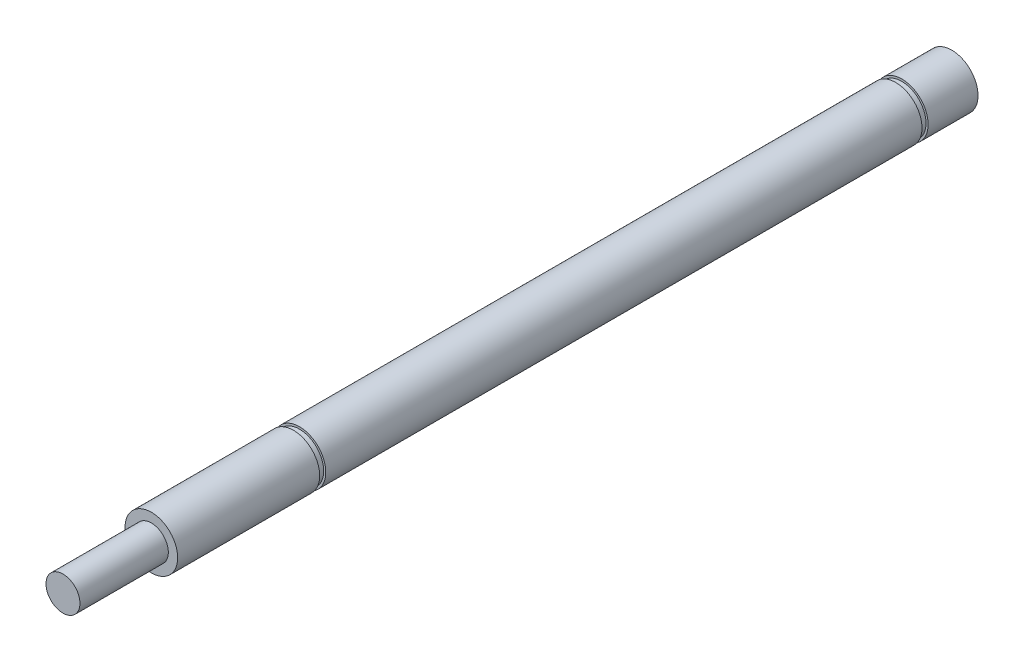
from build123d import *


with BuildPart() as part:
    # Sketch1 → Revolve1 (revolve)
    with BuildSketch(Plane(origin=(15.304322218, 0, 0), x_dir=(0, 0, -1), z_dir=(1, 0, 0)), mode=Mode.PRIVATE) as revolve1_sk:
        Polygon((13.97, 27.878467802), (-3.175, 27.878467802), (-3.175, 26.753467802), (-13.843, 26.753467802), (-13.843, 24.703467802), (93.445553682, 24.703467802), (93.445553682, 27.878467802), (87.419403682, 27.878467802), (87.419403682, 27.624467802), (86.682803682, 27.624467802), (86.682803682, 27.878467802), (65.655613748, 27.878467802), (14.7066, 27.878467802), (14.7066, 27.624467802), (13.97, 27.624467802), align=None)
    revolve(revolve1_sk.sketch.rotate(Axis((15.304322218, 24.703467802, -93.445553682), (0, 0, 1)), 90), axis=Axis((15.304322218, 24.703467802, -93.445553682), (0, 0, 1)))


solid = part.part
